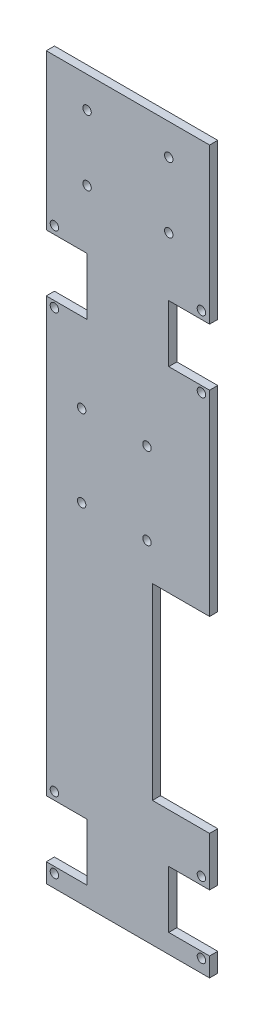
from build123d import *

# Parameters (mm, degrees)
EXTRUDE_1_DEPTH     = 3
SKETCH_4_W          = 15
SKETCH_4_H          = 21
CUT_EXTRUDE_1_DEPTH = 3
SKETCH_5_R          = 1.55
CUT_EXTRUDE_2_DEPTH = 272.724124803
SKETCH_7_W          = 21
SKETCH_7_H          = 69
CUT_EXTRUDE_3_DEPTH = 272.724124803


with BuildPart() as part:
    # 草图1 → 凸台-拉伸1 (new body)
    with BuildSketch(Plane.XY):
        Polygon((0, 240), (0, 265), (60, 265), (60, 240), (60, 0), (0, 0), align=None)
    extrude(amount=EXTRUDE_1_DEPTH)

    # 草图4 → 切除-拉伸1 (cut)
    with BuildSketch(Plane(origin=(0, 0, 0), x_dir=(-1, 0, 0), z_dir=(0, 0, -1))):
        with Locations((-52.5, 17.5)):
            Rectangle(SKETCH_4_W, SKETCH_4_H)
        with Locations((-7.5, 17.5)):
            Rectangle(SKETCH_4_W, SKETCH_4_H)
        with Locations((-7.5, 197.5)):
            Rectangle(SKETCH_4_W, SKETCH_4_H)
        with Locations((-52.5, 197.5)):
            Rectangle(SKETCH_4_W, SKETCH_4_H)
    extrude(amount=-CUT_EXTRUDE_1_DEPTH, mode=Mode.SUBTRACT)

    # 草图5 → 切除-拉伸2 (cut, through all)
    with BuildSketch(Plane(origin=(0, 0, 0), x_dir=(-1, 0, 0), z_dir=(0, 0, -1))):
        with Locations((-45, 229.6)):
            Circle(SKETCH_5_R)
        with Locations((-45, 253.6)):
            Circle(SKETCH_5_R)
        with Locations((-15, 253.6)):
            Circle(SKETCH_5_R)
        with Locations((-15, 229.6)):
            Circle(SKETCH_5_R)
        with Locations((-57, 184.75)):
            Circle(SKETCH_5_R)
        with Locations((-3, 184.75)):
            Circle(SKETCH_5_R)
        with Locations((-3, 210.85)):
            Circle(SKETCH_5_R)
        with Locations((-57, 210.85)):
            Circle(SKETCH_5_R)
        with Locations((-13, 127.7)):
            Circle(SKETCH_5_R)
        with Locations((-37, 127.7)):
            Circle(SKETCH_5_R)
        with Locations((-37, 157.7)):
            Circle(SKETCH_5_R)
        with Locations((-13, 157.7)):
            Circle(SKETCH_5_R)
        with Locations((-57, 4.75)):
            Circle(SKETCH_5_R)
        with Locations((-3, 4.75)):
            Circle(SKETCH_5_R)
        with Locations((-3, 30.85)):
            Circle(SKETCH_5_R)
        with Locations((-57, 30.85)):
            Circle(SKETCH_5_R)
    extrude(amount=-CUT_EXTRUDE_2_DEPTH, mode=Mode.SUBTRACT)

    # 草图7 → 切除-拉伸3 (cut, through all)
    with BuildSketch(Plane(origin=(0, 0, 0), x_dir=(-1, 0, 0), z_dir=(0, 0, -1))):
        with Locations((-49.5, 80.5)):
            Rectangle(SKETCH_7_W, SKETCH_7_H)
    extrude(amount=-CUT_EXTRUDE_3_DEPTH, mode=Mode.SUBTRACT)


solid = part.part
